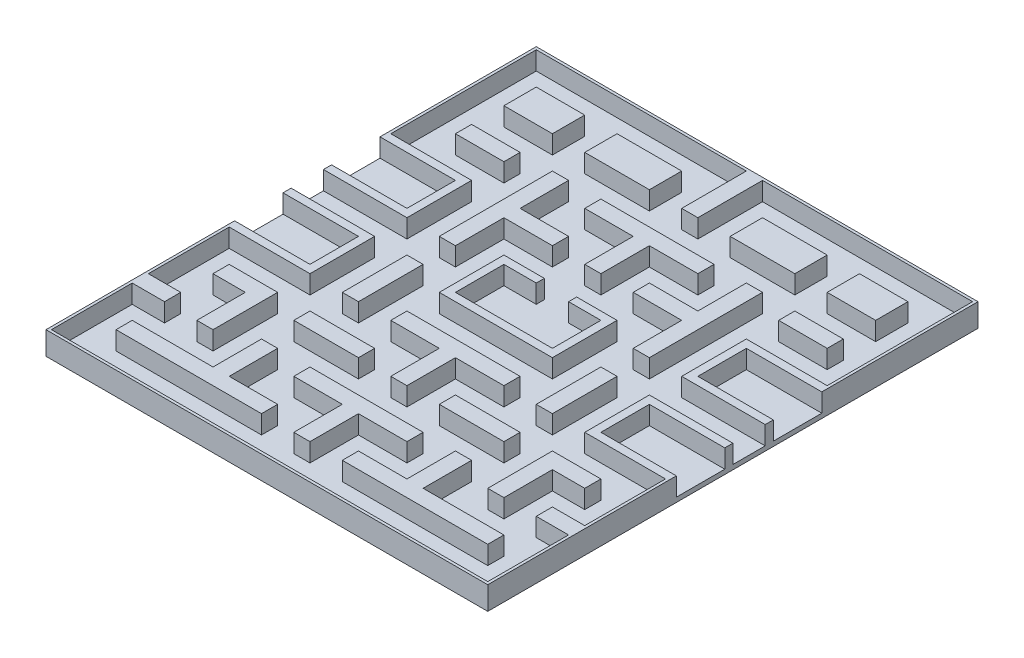
from build123d import *

# Parameters (mm, degrees)
SKETCH1_W               = 2489.2
SKETCH1_H               = 3200.4
BOSS_EXTRUDE2_DEPTH     = 25.4
SKETCH6_W               = 266.7
SKETCH6_H               = 177.8
SKETCH6_W_2             = 355.6
SKETCH6_H_2             = 88.9
SKETCH6_W_3             = 88.9
SKETCH6_H_3             = 355.6
BOSS_EXTRUDE3_DEPTH     = 101.6
SKETCH8_W               = 2489.2
SKETCH8_H               = 296.33672
CUT_EXTRUDE1_DEPTH      = 2032.206094911
CUT_EXTRUDE2_DEPTH      = 2032.206094911
CUT_EXTRUDE2_DEPTH_BACK = 2032.206094911
SKETCH9_W               = 2489.2
SKETCH9_H               = 207.43672
SKETCH10_W              = 29.63672
SKETCH10_H              = 2696.62656
CUT_EXTRUDE3_DEPTH      = 1873.150558614
SKETCH11_W              = 29.636719999
SKETCH11_H              = 2696.62656
CUT_EXTRUDE4_DEPTH      = 1873.150558614


with BuildPart() as part:
    # Sketch1 → Boss-Extrude2 (new body)
    with BuildSketch(Plane(origin=(0, 0, 0), x_dir=(1, 0, 0), z_dir=(0, 1, 0))):
        Rectangle(SKETCH1_W, SKETCH1_H)
    extrude(amount=BOSS_EXTRUDE2_DEPTH)

    # Sketch6 → Boss-Extrude3 (add)
    with BuildSketch(Plane(origin=(0, 25.4, 0), x_dir=(1, 0, 0), z_dir=(0, 1, 0))):
        Polygon((1244.6, 1333.5), (-1244.6, 1333.5), (-1244.6, 444.5), (-800.1, 444.5), (-800.1, 177.8), (-1244.6, 177.8), (-1244.6, 133.35), (-755.65, 133.35), (-755.65, 488.95), (-1200.15, 488.95), (-1200.15, 1289.05), (-44.45, 1289.05), (-44.45, 933.45), (44.45, 933.45), (44.45, 1289.05), (1200.15, 1289.05), (1200.15, 488.95), (755.65, 488.95), (755.65, 133.35), (1244.6, 133.35), (1244.6, 177.8), (800.1, 177.8), (800.1, 444.5), (1244.6, 444.5), align=None)
        with Locations((-889, 1022.35)):
            Rectangle(SKETCH6_W, SKETCH6_H)
        with Locations((-400.05, 1022.35)):
            Rectangle(SKETCH6_W_2, SKETCH6_H)
        with Locations((400.05, 1022.35)):
            Rectangle(SKETCH6_W_2, SKETCH6_H)
        with Locations((889, 1022.35)):
            Rectangle(SKETCH6_W, SKETCH6_H)
        with Locations((889, 711.2)):
            Rectangle(SKETCH6_W, SKETCH6_H_2)
        Polygon((577.85, 755.65), (577.85, 133.35), (488.95, 133.35), (488.95, 400.05), (222.25, 400.05), (222.25, 488.95), (488.95, 488.95), (488.95, 755.65), align=None)
        Polygon((311.15, 755.65), (311.15, 666.75), (44.45, 666.75), (44.45, 400.05), (-44.45, 400.05), (-44.45, 666.75), (-311.15, 666.75), (-311.15, 755.65), align=None)
        Polygon((-488.95, 488.95), (-488.95, 755.65), (-577.85, 755.65), (-577.85, 133.35), (-488.95, 133.35), (-488.95, 400.05), (-222.25, 400.05), (-222.25, 488.95), align=None)
        with Locations((-889, 711.2)):
            Rectangle(SKETCH6_W, SKETCH6_H_2)
        Polygon((-311.15, -133.35), (311.15, -133.35), (311.15, 222.25), (88.9, 222.25), (88.9, 177.8), (266.7, 177.8), (266.7, -88.9), (-266.7, -88.9), (-266.7, 177.8), (-88.9, 177.8), (-88.9, 222.25), (-311.15, 222.25), align=None)
        with Locations((-533.4, -222.25)):
            Rectangle(SKETCH6_W_3, SKETCH6_H_3)
        Polygon((-755.65, -44.45), (-1244.6, -44.45), (-1244.6, -88.9), (-800.1, -88.9), (-800.1, -355.6), (-1244.6, -355.6), (-1244.6, -1422.4), (1244.600000001, -1422.4), (1244.6, -355.6), (800.1, -355.6), (800.1, -88.9), (1244.6, -88.9), (1244.6, -44.45), (755.65, -44.45), (755.65, -400.05), (1200.15, -400.05), (1200.15, -844.549999958), (1022.350000001, -844.549999958), (1022.350000001, -933.449999958), (1200.150000001, -933.449999958), (1200.150000001, -1377.95), (-1200.15, -1377.95), (-1200.15, -933.45), (-1022.35, -933.45), (-1022.35, -844.55), (-1200.15, -844.55), (-1200.15, -400.05), (-755.65, -400.05), align=None)
        Polygon((311.15, -400.05), (44.45, -400.05), (44.45, -666.75), (-44.45, -666.75), (-44.45, -400.05), (-311.15, -400.05), (-311.15, -311.15), (311.15, -311.15), align=None)
        with Locations((533.4, -222.25)):
            Rectangle(SKETCH6_W_3, SKETCH6_H_3)
        with Locations((400.05, -622.3)):
            Rectangle(SKETCH6_W_2, SKETCH6_H_2)
        Polygon((755.65, -577.85), (1022.35, -577.85), (1022.35, -666.75), (844.55, -666.75), (844.55, -933.45), (755.65, -933.45), align=None)
        Polygon((577.85, -1111.25), (1022.35, -1111.25), (1022.35, -1200.15), (222.25, -1200.15), (222.25, -1111.25), (488.95, -1111.25), (488.95, -844.55), (577.85, -844.55), align=None)
        Polygon((311.15, -844.55), (311.15, -933.45), (44.45, -933.45), (44.45, -1200.15), (-44.45, -1200.15), (-44.45, -933.45), (-311.15, -933.45), (-311.15, -844.55), align=None)
        Polygon((-488.95, -1111.25), (-488.95, -844.55), (-577.85, -844.55), (-577.85, -1111.25), (-1022.35, -1111.25), (-1022.35, -1200.15), (-222.25, -1200.15), (-222.25, -1111.25), align=None)
        Polygon((-844.55, -933.45), (-755.65, -933.45), (-755.65, -577.85), (-1022.35, -577.85), (-1022.35, -666.75), (-844.55, -666.75), align=None)
        with Locations((-400.05, -622.3)):
            Rectangle(SKETCH6_W_2, SKETCH6_H_2)
    extrude(amount=BOSS_EXTRUDE3_DEPTH)

    # Sketch8 → Cut-Extrude1 (cut, through all)
    with BuildSketch(Plane(origin=(0, 127, 0), x_dir=(1, 0, 0), z_dir=(0, 1, 0))):
        with Locations((0, 1452.03164)):
            Rectangle(SKETCH8_W, SKETCH8_H)
    extrude(amount=-CUT_EXTRUDE1_DEPTH, mode=Mode.SUBTRACT)

    # Sketch9 → Cut-Extrude2 (cut, two sides: drawn at the far end of the back side and taken through both)
    with BuildSketch(Plane(origin=(0, 127, 0), x_dir=(1, 0, 0), z_dir=(0, 1, 0)).offset(-CUT_EXTRUDE2_DEPTH_BACK)):
        with Locations((0, -1496.48164)):
            Rectangle(SKETCH9_W, SKETCH9_H)
    extrude(amount=CUT_EXTRUDE2_DEPTH + CUT_EXTRUDE2_DEPTH_BACK, mode=Mode.SUBTRACT)

    # Sketch10 → Cut-Extrude3 (cut, through all)
    with BuildSketch(Plane(origin=(0, 127, 0), x_dir=(1, 0, 0), z_dir=(0, 1, 0))):
        with Locations((-1229.78164, -44.45)):
            Rectangle(SKETCH10_W, SKETCH10_H)
    extrude(amount=-CUT_EXTRUDE3_DEPTH, mode=Mode.SUBTRACT)

    # Sketch11 → Cut-Extrude4 (cut, through all)
    with BuildSketch(Plane(origin=(0, 127, 0), x_dir=(1, 0, 0), z_dir=(0, 1, 0))):
        with Locations((1229.781640001, -44.45)):
            Rectangle(SKETCH11_W, SKETCH11_H)
    extrude(amount=-CUT_EXTRUDE4_DEPTH, mode=Mode.SUBTRACT)


solid = part.part
